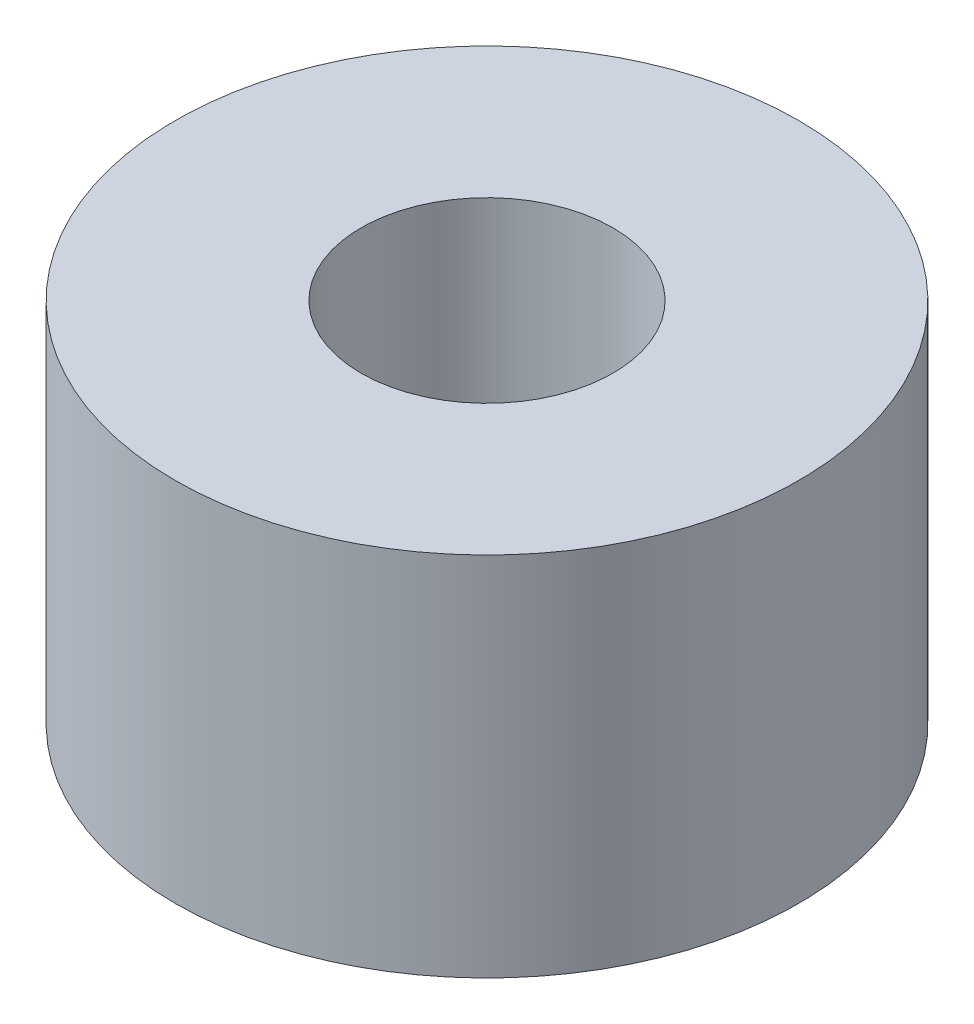
from build123d import *

# Parameters (mm, degrees)
SKETCH1_R           = 4.95
SKETCH1_R_2         = 2
BOSS_EXTRUDE1_DEPTH = 5.8166


with BuildPart() as part:
    # Sketch1 → Boss-Extrude1 (new body)
    with BuildSketch(Plane(origin=(0, 0, 0), x_dir=(1, 0, 0), z_dir=(0, 1, 0))):
        with Locations(Location((0, 0, 0), (0, 0, 270))):
            Circle(SKETCH1_R)
        with Locations(Location((0, 0, 0), (0, 0, 270))):
            Circle(SKETCH1_R_2, mode=Mode.SUBTRACT)
    extrude(amount=BOSS_EXTRUDE1_DEPTH)


solid = part.part
